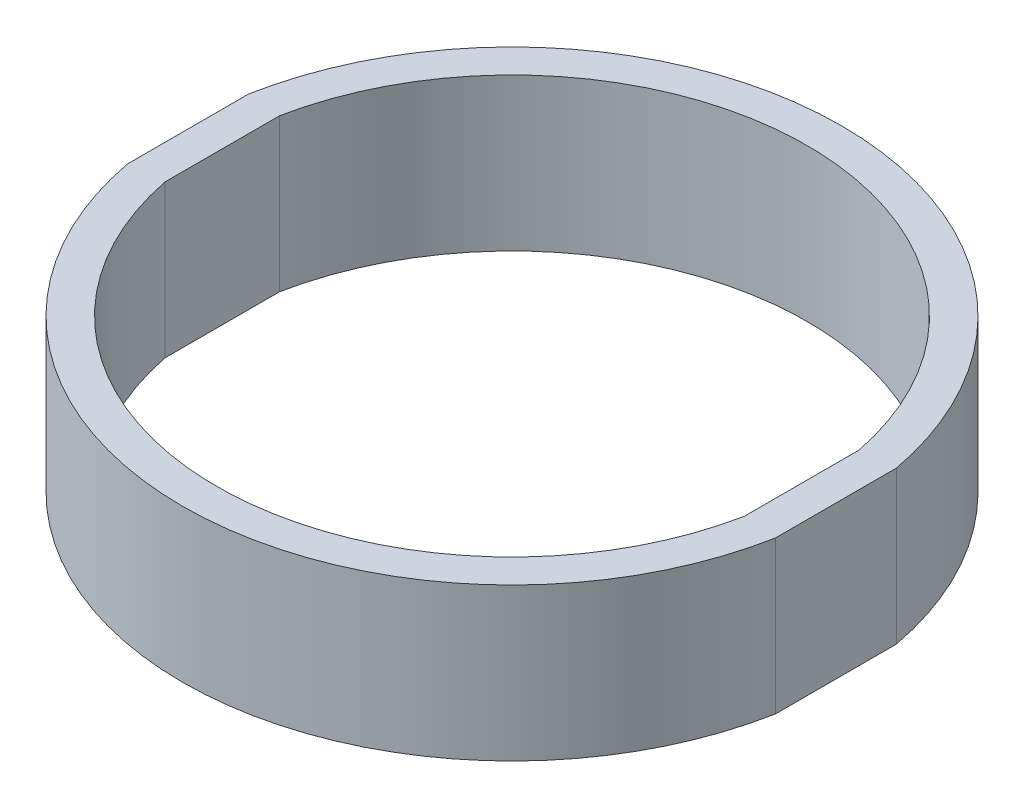
from build123d import *

# Parameters (mm, degrees)
BOSS_EXTRUDE1_DEPTH = 10


with BuildPart() as part:
    # Sketch1 → Boss-Extrude1 (new body)
    with BuildSketch(Plane(origin=(0, 0, 0), x_dir=(1, 0, 0), z_dir=(0, 1, 0))):
        with BuildLine():
            Line((-21.25, 3.96382225), (-21.25, -3.96382225))
            ThreePointArc((-21.25, -3.96382225), (0, -21.616530407), (21.25, -3.96382225))
            Line((21.25, -3.96382225), (21.25, 3.96382225))
            ThreePointArc((21.25, 3.96382225), (0, 21.616530407), (-21.25, 3.96382225))
        make_face()
        with BuildLine():
            Line((19, 3.75), (19, -3.75))
            ThreePointArc((19, -3.75), (0, -19.366530407), (-19, -3.75))
            Line((-19, -3.75), (-19, 3.75))
            ThreePointArc((-19, 3.75), (0, 19.366530407), (19, 3.75))
        make_face(mode=Mode.SUBTRACT)
    extrude(amount=BOSS_EXTRUDE1_DEPTH)


solid = part.part
